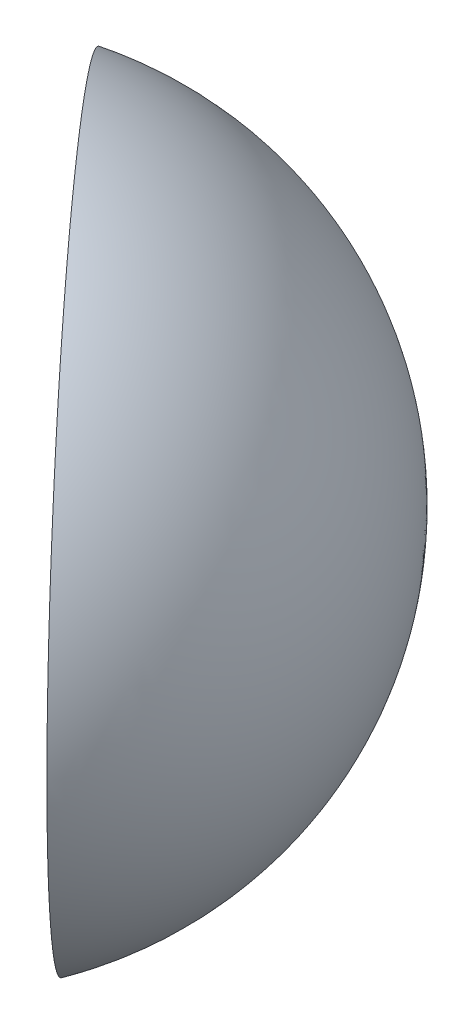
from build123d import *


with BuildPart() as part:
    # Sketch4 → Revolve10 (revolve)
    with BuildSketch(Plane(origin=(0, 0, 0), x_dir=(1, 0, 0), z_dir=(0, 1, 0))):
        with BuildLine():
            Line((-12.4608427, 20.59128812), (-11.653453089, 21.292948139))
            ThreePointArc((-11.653453089, 21.292948139), (-12.464700391, 21.775673873), (-13.403417885, 21.675895182))
            Line((-13.403417885, 21.675895182), (-12.4608427, 20.59128812))
        make_face()
    revolve(axis=Axis((-12.4608427, 0, -20.59128812), (0.7547989382759128, 0, -0.6559562201683545)))


solid = part.part
